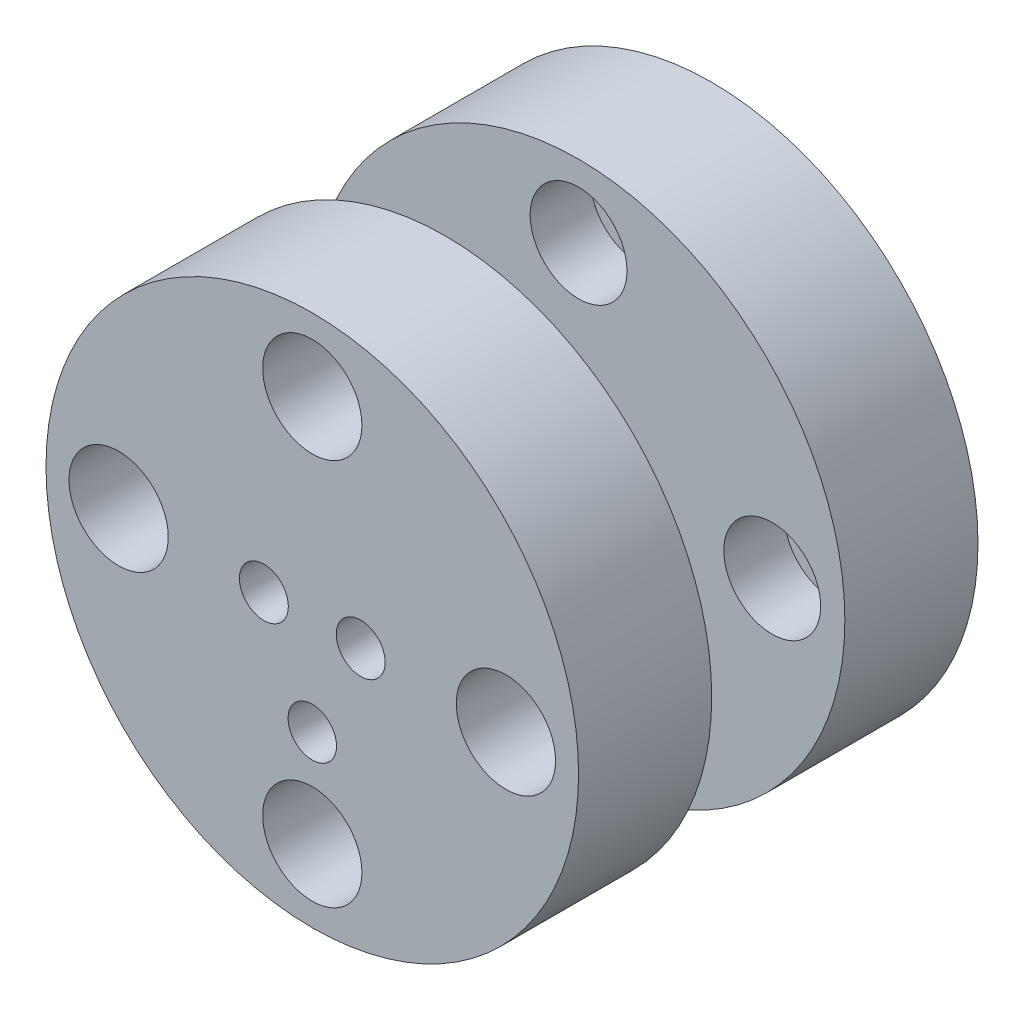
from build123d import *

# Parameters (mm, degrees)
SKETCH_1_R          = 11
SKETCH_1_R_2        = 1.15
EXTRUDE_1_DEPTH     = 5.5
SKETCH_2_R          = 3
EXTRUDE_2_DEPTH     = 5.5
SKETCH_3_R          = 11
SKETCH_3_R_2        = 2.05
EXTRUDE_3_DEPTH     = 5.5
CUT_EXTRUDE_START   = -16.5
SKETCH_8_R          = 1.01
CUT_EXTRUDE_4_DEPTH = 16.5
SKETCH_9_R          = 0.8
CUT_EXTRUDE_5_DEPTH = 5.5
SKETCH_12_R         = 2
CUT_EXTRUDE_7_DEPTH = 2.5
SKETCH_13_R         = 1
CUT_EXTRUDE_8_DEPTH = 5.5


with BuildPart() as part:
    # ｽｹｯﾁ1 → ﾎﾞｽ - 押し出し1 (new body)
    with BuildSketch(Plane.XY):
        Circle(SKETCH_1_R)
        with Locations((-8, 0)):
            Circle(SKETCH_1_R_2, mode=Mode.SUBTRACT)
        with Locations((0, 8)):
            Circle(SKETCH_1_R_2, mode=Mode.SUBTRACT)
        with Locations((8, 0)):
            Circle(SKETCH_1_R_2, mode=Mode.SUBTRACT)
        with Locations((0, -8)):
            Circle(SKETCH_1_R_2, mode=Mode.SUBTRACT)
    extrude(amount=EXTRUDE_1_DEPTH)

    # ｽｹｯﾁ9 → ｶｯﾄ - 押し出し5 (cut)
    with BuildSketch(Plane.XY.offset(5.5)):
        with Locations((-2, 0)):
            Circle(SKETCH_9_R)
        with Locations((2, 0)):
            Circle(SKETCH_9_R)
    extrude(amount=-CUT_EXTRUDE_5_DEPTH, mode=Mode.SUBTRACT)

    # ｽｹｯﾁ12 → ｶｯﾄ - 押し出し7 (cut)
    with BuildSketch(Plane.XY.offset(5.5)):
        with Locations((-8, 0)):
            Circle(SKETCH_12_R)
        with Locations((0, 8)):
            Circle(SKETCH_12_R)
        with Locations((8, 0)):
            Circle(SKETCH_12_R)
        with Locations((0, -8)):
            Circle(SKETCH_12_R)
    extrude(amount=-CUT_EXTRUDE_7_DEPTH, mode=Mode.SUBTRACT)


with BuildPart() as body_2:
    # ｽｹｯﾁ2 → ﾎﾞｽ - 押し出し2 (new body)
    with BuildSketch(Plane.XY.offset(5.5)):
        Circle(SKETCH_2_R)
    extrude(amount=EXTRUDE_2_DEPTH)


with BuildPart() as body_3:
    # ｽｹｯﾁ3 → ﾎﾞｽ - 押し出し3 (new body)
    with BuildSketch(Plane.XY.offset(11)):
        Circle(SKETCH_3_R)
        with Locations((-8, 0)):
            Circle(SKETCH_3_R_2, mode=Mode.SUBTRACT)
        with Locations((0, 8)):
            Circle(SKETCH_3_R_2, mode=Mode.SUBTRACT)
        with Locations((8, 0)):
            Circle(SKETCH_3_R_2, mode=Mode.SUBTRACT)
        with Locations((0, -8)):
            Circle(SKETCH_3_R_2, mode=Mode.SUBTRACT)
    extrude(amount=EXTRUDE_3_DEPTH)


with BuildPart() as cut_extrude_4_tool:
    # ｽｹｯﾁ8 → ｶｯﾄ - 押し出し4 (new body)
    with BuildSketch(Plane.XY.offset(16.5).offset(CUT_EXTRUDE_START)):
        with Locations((-2, 0)):
            Circle(SKETCH_8_R)
        with Locations((2, 0)):
            Circle(SKETCH_8_R)
    extrude(amount=CUT_EXTRUDE_4_DEPTH)


with BuildPart() as body_2_1:
    add(body_2.part)

    # ｶｯﾄ - 押し出し4: cut by cut_extrude_4_tool
    add(cut_extrude_4_tool.part, mode=Mode.SUBTRACT)


with BuildPart() as body_3_1:
    add(body_3.part)

    # ｶｯﾄ - 押し出し4: cut by cut_extrude_4_tool
    add(cut_extrude_4_tool.part, mode=Mode.SUBTRACT)

    # ｽｹｯﾁ13 → ｶｯﾄ - 押し出し8 (cut)
    with BuildSketch(Plane.XY.offset(16.5)):
        with Locations((0, -4)):
            Circle(SKETCH_13_R)
    extrude(amount=-CUT_EXTRUDE_8_DEPTH, mode=Mode.SUBTRACT)


solid = Compound([part.part, body_2_1.part, body_3_1.part])
